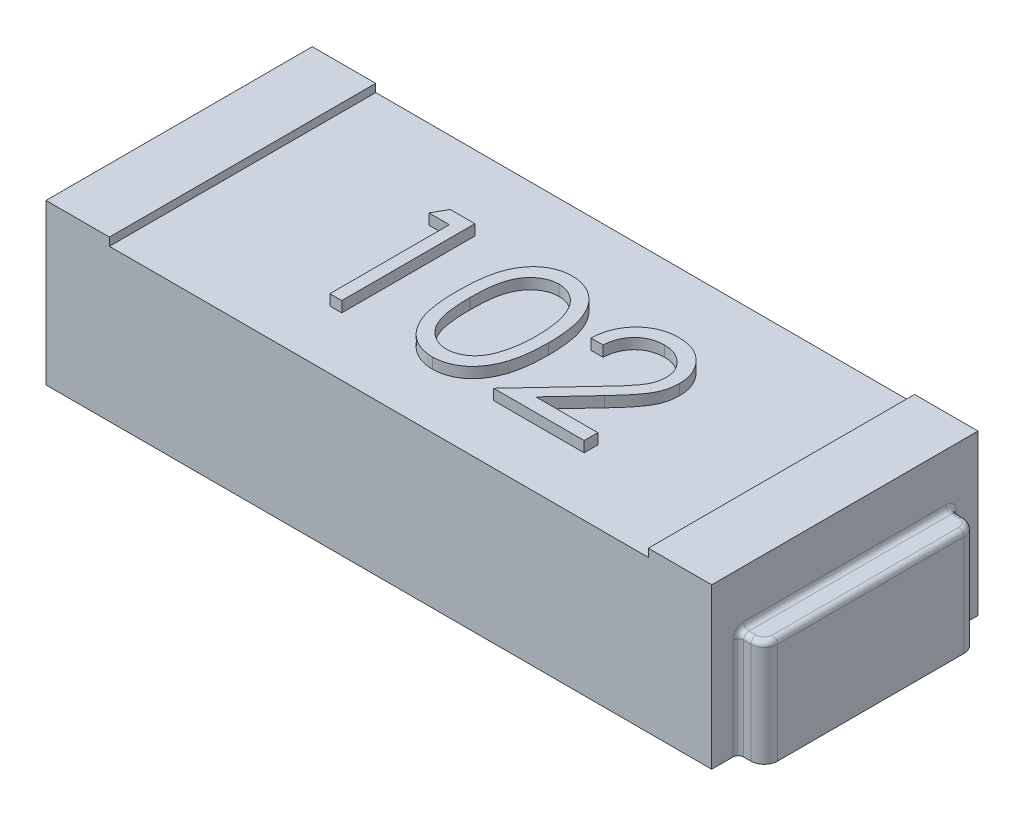
from build123d import *

# Parameters (mm, degrees)
ESQUISSE1_W             = 2.5
ESQUISSE1_H             = 1
BOSS_EXTRU_1_DEPTH      = 0.6
ESQUISSE2_W             = 2.023603034
ESQUISSE2_H             = 1
ENL_V_MAT_EXTRU_1_DEPTH = 0.03
BOSS_EXTRU_2_DEPTH      = 0.4
CONG_1_R                = 0.02
CONG_1_OF_SYM_TRIE2_R   = 0.02
BOSS_EXTRU_3_DEPTH      = 0.04


with BuildPart() as part:
    # Esquisse1 → Boss.-Extru.1 (new body)
    with BuildSketch(Plane(origin=(0, 0, 0), x_dir=(1, 0, 0), z_dir=(0, 1, 0))):
        Rectangle(ESQUISSE1_W, ESQUISSE1_H)
    extrude(amount=BOSS_EXTRU_1_DEPTH)

    # Esquisse2 → Enlèv. mat.-Extru.1 (cut)
    with BuildSketch(Plane(origin=(0, 0.6, 0), x_dir=(1, 0, 0), z_dir=(0, 1, 0))):
        Rectangle(ESQUISSE2_W, ESQUISSE2_H)
    extrude(amount=-ENL_V_MAT_EXTRU_1_DEPTH, mode=Mode.SUBTRACT)

    # Esquisse3 → Boss.-Extru.2 (add)
    with BuildSketch(Plane(origin=(0, 0, 0), x_dir=(1, 0, 0), z_dir=(0, 1, 0))):
        with BuildLine():
            Line((1.25, 0.4), (1.297141448, 0.4))
            ThreePointArc((1.297141448, 0.4), (1.332496787, 0.385355339), (1.347141448, 0.35))
            Line((1.347141448, 0.35), (1.347141448, -0.35))
            ThreePointArc((1.347141448, -0.35), (1.332496787, -0.385355339), (1.297141448, -0.4))
            Line((1.297141448, -0.4), (1.25, -0.4))
            Line((1.25, -0.4), (1.25, 0.4))
        make_face()
    boss_extru_2 = extrude(amount=BOSS_EXTRU_2_DEPTH)

    # Congé1
    cong_1_edges = [part.edges().sort_by_distance(p)[0] for p in [
        (1.25, 0.2, -0.4),
        (1.25, 0.2, 0.4),
        (1.25, 0.4, 0),
        (1.273570724, 0.4, 0.4),
        (1.332496787, 0.4, 0.385355339),
        (1.347141448, 0.4, 0),
        (1.332496787, 0.4, -0.385355339),
        (1.273570724, 0.4, -0.4),
    ]]
    fillet(cong_1_edges, radius=CONG_1_R)

    # Symétrie2: Boss.-Extru.2 across plane
    add(boss_extru_2.mirror(Plane(origin=(0, 0, 0), x_dir=(0, 0, 1), z_dir=(1, 0, 0))))

    # Congé1 of Symétrie2
    cong_1_of_sym_trie2_edges = [part.edges().sort_by_distance(p)[0] for p in [
        (-1.25, 0.2, -0.4),
        (-1.25, 0.2, 0.4),
        (-1.25, 0.4, 0),
        (-1.273570724, 0.4, 0.4),
        (-1.332496787, 0.4, 0.385355339),
        (-1.347141448, 0.4, 0),
        (-1.332496787, 0.4, -0.385355339),
        (-1.273570724, 0.4, -0.4),
    ]]
    fillet(cong_1_of_sym_trie2_edges, radius=CONG_1_OF_SYM_TRIE2_R)

    # Esquisse4 → Boss.-Extru.3 (add)
    # profile 1 of 3: a face of its own
    with BuildSketch(Plane(origin=(0, 0.57, 0), x_dir=(1, 0, 0), z_dir=(0, 1, 0))):
        with BuildLine():
            Line((0.275641026, 0.065854324), (0.230769231, 0.065854324))
            add(Edge.make_bspline(
                [(0.230769231, 0.065854324), (0.231061681, 0.071807307), (0.231636046, 0.08349881), (0.234325802, 0.100545082), (0.238174498, 0.116838625), (0.243616135, 0.132248612), (0.250374174, 0.146911299), (0.258478464, 0.160768444), (0.268077586, 0.173767185), (0.278964262, 0.18578702), (0.290788353, 0.196813816), (0.303546344, 0.206335994), (0.316952777, 0.214381375), (0.330966977, 0.221107267), (0.345747057, 0.226155816), (0.361158894, 0.229901765), (0.377270199, 0.232155528), (0.388247345, 0.232397784), (0.393830128, 0.23252099)],
                knots=[0, 0, 0, 0, 1.10065271, 2.161652631, 3.183658789, 4.190468796, 5.17591951, 6.163126047, 7.15150782, 8.156236427, 9.156009102, 10.134482811, 11.092018607, 12.041330605, 13.001268258, 13.972401359, 14.968799086, 16, 16, 16, 16], degree=3))
            add(Edge.make_bspline(
                [(0.393830128, 0.23252099), (0.39931271, 0.232392639), (0.410085788, 0.232140434), (0.425808933, 0.229974573), (0.440777118, 0.226582346), (0.454961085, 0.221823), (0.468247665, 0.215425225), (0.480736672, 0.207739862), (0.492576787, 0.198851315), (0.503234899, 0.188386485), (0.513021768, 0.177214715), (0.521464947, 0.165287872), (0.528695399, 0.152969403), (0.53472221, 0.140165374), (0.539158802, 0.126755227), (0.542527117, 0.112934198), (0.544431033, 0.098559225), (0.544723237, 0.088829717), (0.544871795, 0.08388317)],
                knots=[0, 0, 0, 0, 1.111607364, 2.184268762, 3.212621178, 4.221274766, 5.211760367, 6.196651075, 7.1921475, 8.207485113, 9.220403448, 10.201281604, 11.166441695, 12.114753415, 13.065576456, 14.026450734, 14.996634279, 16, 16, 16, 16], degree=3))
            add(Edge.make_bspline(
                [(0.544871795, 0.08388317), (0.5446299, 0.076919193), (0.544150356, 0.063113449), (0.540048302, 0.042825611), (0.533641657, 0.023169408), (0.525927749, 0.007349794), (0.518145972, -0.005397848), (0.511133471, -0.015893378), (0.502924212, -0.027194159), (0.493398712, -0.03926235), (0.482754016, -0.052192479), (0.470893707, -0.065976736), (0.45773321, -0.080472703), (0.448496281, -0.090373503), (0.443709936, -0.09550385)],
                knots=[0, 0, 0, 0, 1.184426356, 2.348067706, 3.509069118, 4.696110526, 5.333549288, 6.050745305, 6.844228056, 7.710549037, 8.667450064, 9.695053472, 10.805634456, 12, 12, 12, 12], degree=3))
            Line((0.443709936, -0.09550385), (0.318609776, -0.229017471))
            Line((0.318609776, -0.229017471), (0.551282051, -0.229017471))
            Line((0.551282051, -0.229017471), (0.551282051, -0.280299523))
            Line((0.551282051, -0.280299523), (0.211538462, -0.280299523))
            Line((0.211538462, -0.280299523), (0.405448718, -0.073368433))
            add(Edge.make_bspline(
                [(0.405448718, -0.073368433), (0.410169845, -0.068440103), (0.419238163, -0.058973791), (0.432064245, -0.045153368), (0.443584101, -0.032332005), (0.4538723, -0.020533927), (0.462705658, -0.00958656), (0.470544548, 0.000155541), (0.476825347, 0.009120462), (0.483641832, 0.019511978), (0.490243829, 0.032199452), (0.495917023, 0.047704265), (0.499376287, 0.063665301), (0.499791263, 0.074451306), (0.5, 0.079876759)],
                knots=[0, 0, 0, 0, 1.329631726, 2.553950428, 3.673215718, 4.687767853, 5.603093632, 6.413772471, 7.123043292, 7.734684054, 8.834405432, 9.900288307, 10.943827018, 12, 12, 12, 12], degree=3))
            add(Edge.make_bspline(
                [(0.5, 0.079876759), (0.49990918, 0.083288388), (0.49973019, 0.090012052), (0.498150519, 0.099870018), (0.495763304, 0.109379277), (0.492342553, 0.11856908), (0.487827304, 0.12734703), (0.482331107, 0.135723813), (0.47598967, 0.143822236), (0.468653774, 0.151415565), (0.460594985, 0.158370023), (0.452081521, 0.164530606), (0.443074363, 0.169679051), (0.433611489, 0.17389955), (0.423719279, 0.177210319), (0.413378601, 0.179504402), (0.402618027, 0.180944757), (0.395270385, 0.181139638), (0.391526442, 0.181238939)],
                knots=[0, 0, 0, 0, 0.991446411, 1.95395049, 2.89581595, 3.838931463, 4.798493298, 5.75982156, 6.748411868, 7.785213223, 8.824556874, 9.840280684, 10.836137867, 11.835679398, 12.848801643, 13.863922112, 14.911575587, 16, 16, 16, 16], degree=3))
            add(Edge.make_bspline(
                [(0.391526442, 0.181238939), (0.387616323, 0.181136791), (0.379937495, 0.180936191), (0.368663348, 0.179532953), (0.357908237, 0.177112119), (0.347645108, 0.173801165), (0.337856595, 0.169592801), (0.328590303, 0.164351123), (0.319867034, 0.158096338), (0.311670387, 0.15100483), (0.30411839, 0.143109459), (0.297483122, 0.134308036), (0.291685406, 0.124761262), (0.286626944, 0.114494898), (0.282518988, 0.103415786), (0.279379967, 0.091563257), (0.276896132, 0.078988774), (0.276066343, 0.07030519), (0.275641026, 0.065854324)],
                knots=[0, 0, 0, 0, 1.031018746, 2.02475058, 2.990194455, 3.934040569, 4.864654155, 5.795059489, 6.735614925, 7.690564532, 8.649604399, 9.611025574, 10.590972636, 11.591080095, 12.624614302, 13.701020113, 14.821632451, 16, 16, 16, 16], degree=3))
        make_face()
    # profile 2 of 3: a face of its own
    with BuildSketch(Plane(origin=(0, 0.57, 0), x_dir=(1, 0, 0), z_dir=(0, 1, 0))):
        with BuildLine():
            add(Edge.make_bspline(
                [(-0.173076923, -0.030499843), (-0.173030063, -0.022485931), (-0.172939038, -0.00691879), (-0.171926406, 0.01576473), (-0.170244214, 0.037044772), (-0.167938875, 0.056922352), (-0.16513345, 0.075402605), (-0.16138838, 0.092436141), (-0.157129408, 0.108101799), (-0.152193345, 0.122450663), (-0.14662366, 0.13567605), (-0.140561623, 0.148022507), (-0.133766653, 0.159471354), (-0.126627094, 0.170205324), (-0.11885394, 0.180048709), (-0.110668399, 0.189140518), (-0.101750988, 0.197270626), (-0.092404844, 0.20467724), (-0.082545349, 0.211170022), (-0.07245354, 0.216888984), (-0.062059953, 0.22177468), (-0.051336213, 0.225616171), (-0.040378704, 0.228789149), (-0.029149123, 0.230958998), (-0.017628929, 0.232324271), (-0.009853009, 0.232454795), (-0.005909455, 0.23252099)],
                knots=[0, 0, 0, 0, 1.646270934, 3.197905019, 4.663502075, 6.030701355, 7.308322542, 8.50163776, 9.611534131, 10.641858119, 11.616356847, 12.558055219, 13.465016945, 14.349605745, 15.204443733, 16.039544428, 16.859896111, 17.680448484, 18.487036065, 19.28249412, 20.06191084, 20.843045899, 21.620316918, 22.403196591, 23.190181807, 24, 24, 24, 24], degree=3))
            add(Edge.make_bspline(
                [(-0.005909455, 0.23252099), (-0.001932958, 0.232451302), (0.005975043, 0.232312715), (0.017666525, 0.230980723), (0.029087908, 0.228770563), (0.0401905, 0.225638995), (0.051065498, 0.221753898), (0.061627842, 0.21688431), (0.071943139, 0.211215901), (0.081847466, 0.204555347), (0.091449554, 0.197129307), (0.100513548, 0.18873464), (0.109040275, 0.179456109), (0.117136747, 0.169392986), (0.124573261, 0.158352259), (0.13165518, 0.146525958), (0.137994042, 0.133707263), (0.144098996, 0.120110053), (0.149368565, 0.105358102), (0.154120886, 0.089534565), (0.157960739, 0.072452538), (0.161159206, 0.054201646), (0.163637048, 0.034714862), (0.165441712, 0.01403396), (0.16639501, -0.007854667), (0.166574538, -0.022820074), (0.166666667, -0.030499843)],
                knots=[0, 0, 0, 0, 0.810914788, 1.612654377, 2.396697861, 3.181598691, 3.963628158, 4.749916497, 5.551656086, 6.361998678, 7.18212741, 8.025565596, 8.878627764, 9.750805457, 10.657531673, 11.591944965, 12.560506719, 13.57287815, 14.630710178, 15.753379473, 16.941251878, 18.199788006, 19.531962791, 20.947069417, 22.433333509, 24, 24, 24, 24], degree=3))
            add(Edge.make_bspline(
                [(0.166666667, -0.030499843), (0.166573583, -0.038146116), (0.166392214, -0.053044566), (0.165452398, -0.074834705), (0.163601165, -0.095405854), (0.161285453, -0.114807349), (0.158078172, -0.132958437), (0.154134577, -0.14992193), (0.14975596, -0.165771083), (0.144350989, -0.180376056), (0.138435173, -0.193940588), (0.131998717, -0.206607324), (0.125103027, -0.218488222), (0.117590349, -0.229488186), (0.109582719, -0.239685137), (0.100908749, -0.248899083), (0.091812951, -0.257352037), (0.082182606, -0.264873698), (0.072123813, -0.271457241), (0.061843945, -0.277344934), (0.051160605, -0.282092462), (0.040315897, -0.286168896), (0.029154702, -0.289283247), (0.017690932, -0.291436655), (0.005982898, -0.292946919), (-0.001931611, -0.29306213), (-0.005909455, -0.293120035)],
                knots=[0, 0, 0, 0, 1.561518951, 3.042555995, 4.452378317, 5.7783523, 7.031515105, 8.214008947, 9.334062868, 10.386615937, 11.391082383, 12.354592575, 13.286541444, 14.194233754, 15.072674879, 15.931287219, 16.775624067, 17.606195743, 18.42308326, 19.229000347, 20.022332153, 20.807536673, 21.593273796, 22.3848459, 23.188221202, 24, 24, 24, 24], degree=3))
            add(Edge.make_bspline(
                [(-0.005909455, -0.293120035), (-0.0098529, -0.293053413), (-0.017628604, -0.292922047), (-0.029150379, -0.291562943), (-0.040333585, -0.289377871), (-0.051233407, -0.286318356), (-0.061905766, -0.282573379), (-0.072205236, -0.277694282), (-0.082246333, -0.272075129), (-0.09200227, -0.265675783), (-0.101289721, -0.258344114), (-0.110160951, -0.25023493), (-0.118393096, -0.241145871), (-0.12605511, -0.231220454), (-0.133337123, -0.22054999), (-0.140035605, -0.208988794), (-0.146231441, -0.196582707), (-0.151894797, -0.183251577), (-0.156916034, -0.168800873), (-0.161351421, -0.153065276), (-0.164853444, -0.135905899), (-0.167851009, -0.117460561), (-0.170268778, -0.09765), (-0.171919396, -0.07646346), (-0.172939583, -0.053914145), (-0.173030308, -0.038447034), (-0.173076923, -0.030499843)],
                knots=[0, 0, 0, 0, 0.810891512, 1.598919785, 2.382837074, 3.152667961, 3.926044502, 4.706494248, 5.493654104, 6.291793342, 7.103789334, 7.925228297, 8.761435821, 9.622817696, 10.50288917, 11.416980706, 12.369136599, 13.353924996, 14.394355917, 15.514179734, 16.714354668, 17.994756427, 19.357759367, 20.818452758, 22.365282078, 24, 24, 24, 24], degree=3))
        make_face()
        with BuildLine():
            add(Edge.make_bspline(
                [(-0.128205128, -0.030299523), (-0.128188064, -0.036977908), (-0.128154947, -0.049939343), (-0.127289775, -0.068774095), (-0.126111171, -0.086341285), (-0.124590985, -0.102663218), (-0.122333421, -0.117684649), (-0.11980388, -0.131508889), (-0.116725582, -0.14406278), (-0.113083436, -0.155432467), (-0.108934994, -0.165810906), (-0.104405585, -0.175468222), (-0.099539767, -0.184518499), (-0.094094174, -0.192880443), (-0.088163451, -0.200581323), (-0.081881557, -0.207757442), (-0.075014045, -0.214157011), (-0.06551351, -0.221832276), (-0.052971157, -0.229763581), (-0.037168234, -0.236670165), (-0.020929884, -0.241010516), (-0.009908277, -0.241562481), (-0.004407051, -0.241837984)],
                knots=[0, 0, 0, 0, 1.459021318, 2.831673884, 4.118529203, 5.306027144, 6.411944654, 7.436330062, 8.375795394, 9.233974572, 10.042671642, 10.816086306, 11.563610507, 12.285937304, 12.993564865, 13.685989202, 14.367179055, 15.041617293, 16.353048772, 17.594441528, 18.799311195, 20, 20, 20, 20], degree=3))
            add(Edge.make_bspline(
                [(-0.004407051, -0.241837984), (0.001129759, -0.24160973), (0.012191948, -0.241153692), (0.028353919, -0.236753873), (0.044043957, -0.230115367), (0.056339949, -0.222265723), (0.065694598, -0.214790248), (0.072397025, -0.208416726), (0.078548746, -0.201280174), (0.084383328, -0.193580275), (0.089734625, -0.18516992), (0.094600787, -0.176089552), (0.099041266, -0.166313955), (0.101571129, -0.159489707), (0.102864583, -0.156000644)],
                knots=[0, 0, 0, 0, 1.353760809, 2.704726607, 4.075137775, 5.516104923, 6.260822281, 7.007110065, 7.778089737, 8.566572457, 9.372053459, 10.217411131, 11.088608312, 12, 12, 12, 12], degree=3))
            add(Edge.make_bspline(
                [(0.102864583, -0.156000644), (0.104371979, -0.151539253), (0.107432638, -0.142480715), (0.111377177, -0.128428765), (0.114483663, -0.113685513), (0.117278429, -0.098339068), (0.119186009, -0.082276253), (0.12072141, -0.06554677), (0.121625794, -0.048138004), (0.121737902, -0.036310148), (0.121794872, -0.030299523)],
                knots=[0, 0, 0, 0, 0.884706709, 1.796334032, 2.740027952, 3.714592787, 4.726048262, 5.777819803, 6.87074269, 8, 8, 8, 8], degree=3))
            add(Edge.make_bspline(
                [(0.121794872, -0.030299523), (0.121716273, -0.024289869), (0.121562518, -0.012533703), (0.120974805, 0.00468318), (0.119457152, 0.021035717), (0.117771564, 0.036594356), (0.115286246, 0.051272971), (0.11260656, 0.065194443), (0.109006386, 0.078186304), (0.105160704, 0.090451958), (0.100759219, 0.101852052), (0.095914114, 0.112439736), (0.090739577, 0.122266125), (0.085119257, 0.131304259), (0.079119874, 0.139594623), (0.072583081, 0.146970993), (0.065768171, 0.153661989), (0.056222858, 0.161299499), (0.043726531, 0.169086884), (0.028177153, 0.176253421), (0.011995633, 0.180368891), (0.001056568, 0.180949132), (-0.004407051, 0.181238939)],
                knots=[0, 0, 0, 0, 1.31362396, 2.569729283, 3.763502607, 4.902122613, 5.988968491, 7.01645872, 7.998833611, 8.933434873, 9.825090667, 10.667526885, 11.477055099, 12.250526234, 12.991942729, 13.710640831, 14.402115721, 15.076753259, 16.378508321, 17.609869233, 18.806226677, 20, 20, 20, 20], degree=3))
            add(Edge.make_bspline(
                [(-0.004407051, 0.181238939), (-0.009937136, 0.180948732), (-0.02100738, 0.18036779), (-0.037357087, 0.176268754), (-0.053029138, 0.169124045), (-0.06549242, 0.161273706), (-0.075044389, 0.153796804), (-0.081770488, 0.147313025), (-0.088077084, 0.140220703), (-0.093886756, 0.132449001), (-0.099328082, 0.124096805), (-0.104325369, 0.11509841), (-0.108827845, 0.105408216), (-0.112982779, 0.095034439), (-0.116636034, 0.083665733), (-0.119649458, 0.071127305), (-0.122433322, 0.057347035), (-0.124404075, 0.042244248), (-0.12615604, 0.025918226), (-0.127281947, 0.008307181), (-0.128157841, -0.01055916), (-0.12818905, -0.023587611), (-0.128205128, -0.030299523)],
                knots=[0, 0, 0, 0, 1.207732386, 2.417664972, 3.655092373, 4.956220595, 5.625982001, 6.301752483, 6.994047911, 7.697131622, 8.419323945, 9.170223765, 9.943494443, 10.752040957, 11.610060368, 12.549350801, 13.567764191, 14.679664412, 15.874934091, 17.154273443, 18.533957287, 20, 20, 20, 20], degree=3))
        make_face(mode=Mode.SUBTRACT)
    # profile 3 of 3: a face of its own
    with BuildSketch(Plane(origin=(0, 0.57, 0), x_dir=(1, 0, 0), z_dir=(0, 1, 0))):
        Polygon((-0.451422276, 0.219700477), (-0.358974359, 0.219700477), (-0.358974359, -0.280299523), (-0.403846154, -0.280299523), (-0.403846154, 0.168418426), (-0.480769231, 0.168418426), align=None)
    extrude(amount=BOSS_EXTRU_3_DEPTH)


solid = part.part
